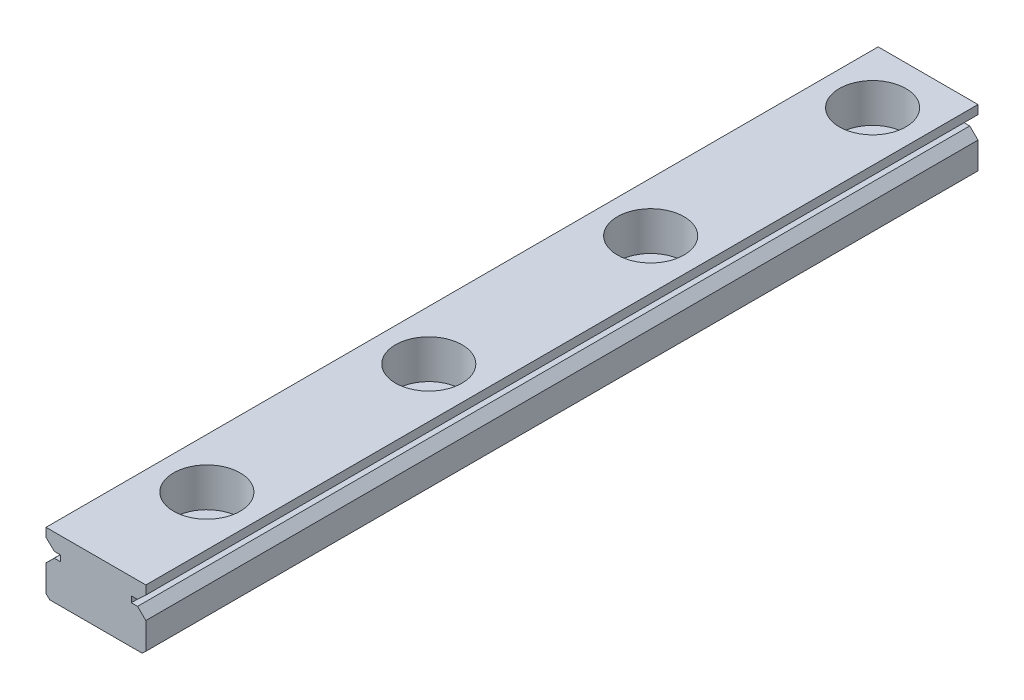
from build123d import *

# Parameters (mm, degrees)
EXTRUDE_1_DEPTH              = 75
HOLE_WIZARD_M6_1_D           = 3.5
HOLE_WIZARD_M6_1_CBORE_D     = 6
HOLE_WIZARD_M6_1_CBORE_DEPTH = 3.5


with BuildPart() as part:
    # Model → 凸台-拉伸1 (new body)
    with BuildSketch(Plane.XY):
        Polygon((176.62288374, 60.355843813), (176.62288374, 54.860433324), (180.778763681, 54.860433324), (181.122753743, 55.174540135), (181.122753743, 56.860433324), (181.122753743, 57.578663559), (180.378777275, 58.313663309), (179.814791529, 58.313663309), (179.814791529, 58.850465041), (180.366775583, 58.850465041), (181.122753743, 59.563028946), (181.122753743, 60.355843813), align=None)
        Polygon((172.123013736, 55.174540135), (172.467003798, 54.860433324), (176.62288374, 54.860433324), (176.62288374, 60.355843813), (172.123013736, 60.355843813), (172.123013736, 59.563028946), (172.878991897, 58.850465041), (173.43097595, 58.850465041), (173.43097595, 58.313663309), (172.866992243, 58.313663309), (172.123013736, 57.578663559), (172.123013736, 56.860433324), align=None)
    extrude(amount=EXTRUDE_1_DEPTH)

    # M6 六角头螺栓的柱形沉头孔1 (through all)
    with Locations(Plane(origin=(176.62288374, 60.355843813, 5), x_dir=(0, 0, 1), z_dir=(0, 1, 0))):
        with Locations((0, 0), (20, 0), (40, 0), (60, 0)):
            CounterBoreHole(HOLE_WIZARD_M6_1_D / 2, HOLE_WIZARD_M6_1_CBORE_D / 2, HOLE_WIZARD_M6_1_CBORE_DEPTH)


solid = part.part
